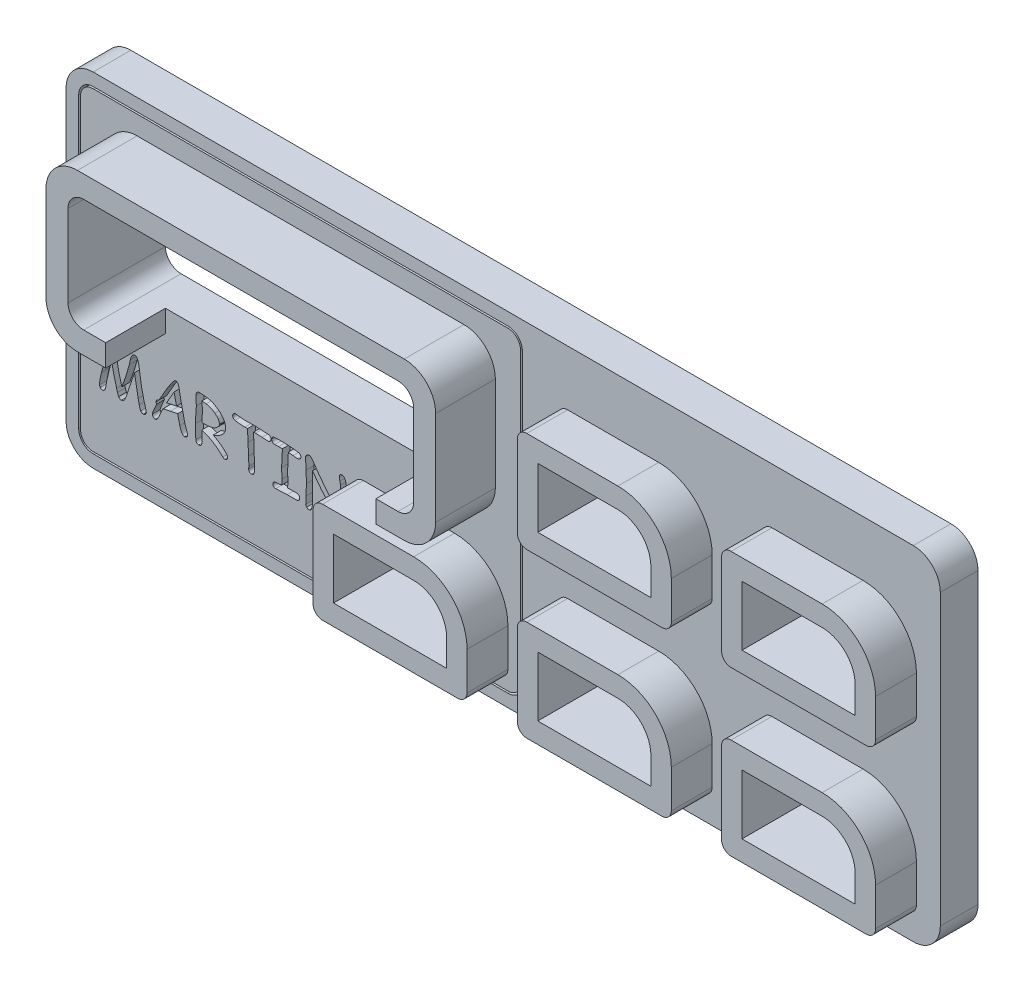
from build123d import *

# Parameters (mm, degrees)
BOSS_EXTRU_1_DEPTH      = 6
BOSS_EXTRU_2_DEPTH      = 9.5
BOSS_EXTRU_3_DEPTH      = 6.5
ENL_V_MAT_EXTRU_1_DEPTH = 87.546230421
ENL_V_MAT_EXTRU_2_DEPTH = 1.25
BOSS_EXTRU_4_DEPTH      = 12.5
BOSS_EXTRU_4_2_DEPTH    = 12.5
BOSS_EXTRU_4_3_DEPTH    = 12.5
BOSS_EXTRU_4_4_DEPTH    = 12.5
BOSS_EXTRU_5_DEPTH      = 6


with BuildPart() as part:
    # Esquisse1 → Boss.-Extru.1 (new body)
    with BuildSketch(Plane.XY):
        with BuildLine():
            Line((2, 0), (68, 0))
            ThreePointArc((68, 0), (69.414213562, 0.585786438), (70, 2))
            Line((70, 2), (70, 48))
            ThreePointArc((70, 48), (69.414213562, 49.414213562), (68, 50))
            Line((68, 50), (2, 50))
            ThreePointArc((2, 50), (0.585786438, 49.414213562), (0, 48))
            Line((0, 48), (0, 2))
            ThreePointArc((0, 2), (0.585786438, 0.585786438), (2, 0))
        make_face()
    extrude(amount=BOSS_EXTRU_1_DEPTH)

    # Esquisse2 → Boss.-Extru.2 (add)
    with BuildSketch(Plane.XY.offset(6)):
        with BuildLine():
            Line((9, 47), (61, 47))
            ThreePointArc((61, 47), (64.535533906, 45.535533906), (66, 42))
            Line((66, 42), (66, 27))
            ThreePointArc((66, 27), (64.535533906, 23.464466094), (61, 22))
            Line((61, 22), (56.5, 22))
            Line((56.5, 22), (56.5, 25.5))
            Line((56.5, 25.5), (60, 25.5))
            ThreePointArc((60, 25.5), (61.767766953, 26.232233047), (62.5, 28))
            Line((62.5, 28), (62.5, 41))
            ThreePointArc((62.5, 41), (61.767766953, 42.767766953), (60, 43.5))
            Line((60, 43.5), (10, 43.5))
            ThreePointArc((10, 43.5), (8.232233047, 42.767766953), (7.5, 41))
            Line((7.5, 41), (7.5, 28))
            ThreePointArc((7.5, 28), (8.232233047, 26.232233047), (10, 25.5))
            Line((10, 25.5), (13.5, 25.5))
            Line((13.5, 25.5), (13.5, 22))
            Line((13.5, 22), (9, 22))
            ThreePointArc((9, 22), (5.464466094, 23.464466094), (4, 27))
            Line((4, 27), (4, 42))
            ThreePointArc((4, 42), (5.464466094, 45.535533906), (9, 47))
        make_face()
    extrude(amount=BOSS_EXTRU_2_DEPTH)

    # Esquisse4 → Boss.-Extru.3 (add)
    with BuildSketch(Plane.XY.offset(6)):
        with BuildLine():
            Line((45, 1.5), (66.5, 1.5))
            ThreePointArc((66.5, 1.5), (67.560660172, 1.939339828), (68, 3))
            Line((68, 3), (68, 9))
            ThreePointArc((68, 9), (65.51040764, 15.01040764), (59.5, 17.5))
            Line((59.5, 17.5), (45, 17.5))
            ThreePointArc((45, 17.5), (43.939339828, 17.060660172), (43.5, 16))
            Line((43.5, 16), (43.5, 3))
            ThreePointArc((43.5, 3), (43.939339828, 1.939339828), (45, 1.5))
        make_face()
        with BuildLine():
            Line((46.75, 4.75), (46.75, 14.25))
            Line((46.75, 14.25), (59.5, 14.25))
            ThreePointArc((59.5, 14.25), (63.212310601, 12.712310601), (64.75, 9))
            Line((64.75, 9), (64.75, 4.75))
            Line((64.75, 4.75), (46.75, 4.75))
        make_face(mode=Mode.SUBTRACT)
    extrude(amount=BOSS_EXTRU_3_DEPTH)

    # Esquisse5 → Enlèv. mat.-Extru.1 (cut, through all)
    with BuildSketch(Plane.XY.offset(6)):
        with BuildLine():
            Line((46.75, 4.75), (64.75, 4.75))
            Line((64.75, 4.75), (64.75, 9))
            ThreePointArc((64.75, 9), (63.212310601, 12.712310601), (59.5, 14.25))
            Line((59.5, 14.25), (46.75, 14.25))
            Line((46.75, 14.25), (46.75, 4.75))
        make_face()
        with BuildLine():
            Line((60, 25.5), (10, 25.5))
            ThreePointArc((10, 25.5), (8.232233047, 26.232233047), (7.5, 28))
            Line((7.5, 28), (7.5, 41))
            ThreePointArc((7.5, 41), (8.232233047, 42.767766953), (10, 43.5))
            Line((10, 43.5), (60, 43.5))
            ThreePointArc((60, 43.5), (61.767766953, 42.767766953), (62.5, 41))
            Line((62.5, 41), (62.5, 28))
            ThreePointArc((62.5, 28), (61.767766953, 26.232233047), (60, 25.5))
        make_face()
    extrude(amount=-ENL_V_MAT_EXTRU_1_DEPTH, mode=Mode.SUBTRACT)

    # Esquisse6 → Enlèv. mat.-Extru.2 (cut)
    # profile 1 of 6: a face of its own
    with BuildSketch(Plane.XY.offset(6)):
        with BuildLine():
            add(Edge.make_bspline(
                [(9.98125, 9.15), (9.94151225, 9.152572673), (9.863195503, 9.157642999), (9.753210696, 9.208851358), (9.655170057, 9.288929049), (9.60457435, 9.360022023), (9.577929688, 9.397460938)],
                knots=[0, 0, 0, 0, 0.959160072, 1.890351017, 2.889018652, 4, 4, 4, 4], degree=3))
            add(Edge.make_bspline(
                [(9.577929688, 9.397460938), (9.555039589, 9.437994011), (9.503936785, 9.528485264), (9.444559776, 9.689977546), (9.383582079, 9.884507049), (9.350820269, 10.027438016), (9.333203125, 10.104296875)],
                knots=[0, 0, 0, 0, 0.742751013, 1.658213032, 2.74074123, 4, 4, 4, 4], degree=3))
            Line((9.333203125, 10.104296875), (9.170507813, 10.897265625))
            add(Edge.make_bspline(
                [(9.170507813, 10.897265625), (9.162063675, 10.930478046), (9.144190904, 11.000775102), (9.120790184, 11.114387165), (9.090669195, 11.240473819), (9.063224027, 11.382219058), (9.030938447, 11.536818991), (9.000199405, 11.706212518), (8.966098288, 11.888970437), (8.928359571, 12.08553135), (8.892511406, 12.296435224), (8.852248192, 12.520464411), (8.811201363, 12.758809908), (8.769390414, 13.011457122), (8.723780906, 13.277899485), (8.677478841, 13.558204991), (8.629563722, 13.852141071), (8.597594428, 14.052724412), (8.58125, 14.155273438)],
                knots=[0, 0, 0, 0, 0.496658207, 1.051221438, 1.68101768, 2.375400972, 3.143623008, 3.970205625, 4.870641242, 5.838436678, 6.871229342, 7.971369117, 9.137717576, 10.376808206, 11.683232474, 13.055897193, 14.494815811, 16, 16, 16, 16], degree=3))
            Line((8.58125, 14.155273438), (7.643359375, 11.373046875))
            Line((7.643359375, 11.373046875), (7.365820313, 10.496679688))
            add(Edge.make_bspline(
                [(7.365820313, 10.496679688), (7.338399285, 10.413435477), (7.285871215, 10.253971808), (7.197076337, 10.029299386), (7.110227316, 9.826640315), (7.045261396, 9.702448964), (7.014453125, 9.643554688)],
                knots=[0, 0, 0, 0, 1.138108356, 2.180174859, 3.13699879, 4, 4, 4, 4], degree=3))
            add(Edge.make_bspline(
                [(7.014453125, 9.643554688), (6.998289241, 9.617971786), (6.966916713, 9.568317859), (6.909732883, 9.50452134), (6.850756066, 9.448298498), (6.786364608, 9.402949233), (6.717025251, 9.368507163), (6.643911558, 9.343787748), (6.566658978, 9.328283944), (6.513679359, 9.326107542), (6.48671875, 9.325)],
                knots=[0, 0, 0, 0, 1.12138879, 2.176506675, 3.170017907, 4.141537379, 5.087232601, 6.03413754, 6.999599269, 8, 8, 8, 8], degree=3))
            add(Edge.make_bspline(
                [(6.48671875, 9.325), (6.442895177, 9.327946144), (6.356824973, 9.333732419), (6.236381954, 9.386429395), (6.131236088, 9.471412651), (6.080120224, 9.547570594), (6.053320313, 9.5875)],
                knots=[0, 0, 0, 0, 0.986319395, 1.937147192, 2.918451782, 4, 4, 4, 4], degree=3))
            add(Edge.make_bspline(
                [(6.053320313, 9.5875), (6.035855727, 9.621866875), (5.999476197, 9.693454648), (5.954588697, 9.811564935), (5.90666618, 9.940597662), (5.880828501, 10.032979854), (5.867382813, 10.081054688)],
                knots=[0, 0, 0, 0, 0.874902059, 1.822461019, 2.866828981, 4, 4, 4, 4], degree=3))
            Line((5.867382813, 10.081054688), (5.733398438, 10.59375))
            add(Edge.make_bspline(
                [(5.733398438, 10.59375), (5.656503387, 10.869589158), (5.500506422, 11.429183974), (5.28647453, 12.287066879), (5.086738125, 13.173788865), (4.966930141, 13.776291049), (4.90625, 14.081445313)],
                knots=[0, 0, 0, 0, 0.958328754, 1.944161251, 2.958762347, 4, 4, 4, 4], degree=3))
            Line((4.90625, 14.081445313), (4.743554688, 13.2625))
            Line((4.743554688, 13.2625), (4.1625, 10.8453125))
            add(Edge.make_bspline(
                [(4.1625, 10.8453125), (4.159128915, 10.807911974), (4.151961622, 10.7283944), (4.134718723, 10.603184869), (4.114668068, 10.464942037), (4.08826968, 10.314124246), (4.056624354, 10.150630351), (4.021006682, 9.974272122), (3.981550861, 9.784994838), (3.952148665, 9.654905267), (3.936914063, 9.5875)],
                knots=[0, 0, 0, 0, 0.704684958, 1.498236636, 2.371575818, 3.326349705, 4.371405418, 5.496944069, 6.703053969, 8, 8, 8, 8], degree=3))
            add(Edge.make_bspline(
                [(3.936914063, 9.5875), (3.925292565, 9.559816052), (3.902977927, 9.506659624), (3.859959142, 9.435525488), (3.813644305, 9.373538656), (3.759625567, 9.323968639), (3.70011878, 9.284889215), (3.634820258, 9.257348339), (3.564073136, 9.240403308), (3.515005519, 9.238484143), (3.48984375, 9.2375)],
                knots=[0, 0, 0, 0, 1.182980922, 2.271462135, 3.271240398, 4.225523803, 5.148115151, 6.066492127, 7.00850128, 8, 8, 8, 8], degree=3))
            add(Edge.make_bspline(
                [(3.48984375, 9.2375), (3.454472301, 9.238987729), (3.386404423, 9.241850676), (3.290904348, 9.273867009), (3.20538017, 9.323395776), (3.161073954, 9.371539251), (3.138476563, 9.39609375)],
                knots=[0, 0, 0, 0, 1.060616523, 2.041022336, 3.000867405, 4, 4, 4, 4], degree=3))
            add(Edge.make_bspline(
                [(3.138476563, 9.39609375), (3.12104166, 9.419179036), (3.085832988, 9.465798296), (3.051523678, 9.547863698), (3.028089071, 9.636777468), (3.026050694, 9.698987924), (3.025, 9.731054688)],
                knots=[0, 0, 0, 0, 0.958743918, 1.936122096, 2.936161401, 4, 4, 4, 4], degree=3))
            add(Edge.make_bspline(
                [(3.025, 9.731054688), (3.026353012, 9.795783944), (3.029137867, 9.929013783), (3.042627838, 10.133943057), (3.068218521, 10.349523947), (3.102129656, 10.575737195), (3.146634661, 10.81314601), (3.199268474, 11.061430494), (3.264501854, 11.319927567), (3.312277094, 11.495260953), (3.33671875, 11.584960938)],
                knots=[0, 0, 0, 0, 0.824042072, 1.69609536, 2.612788883, 3.586582681, 4.607146524, 5.686861406, 6.816605879, 8, 8, 8, 8], degree=3))
            Line((3.33671875, 11.584960938), (3.833007813, 13.445703125))
            Line((3.833007813, 13.445703125), (4.094140625, 14.899023438))
            add(Edge.make_bspline(
                [(4.094140625, 14.899023438), (4.110582906, 14.980233399), (4.142162068, 15.136205836), (4.19403641, 15.358138464), (4.245898421, 15.558306367), (4.297370459, 15.736416976), (4.349692009, 15.892468872), (4.405229653, 16.025660067), (4.45769822, 16.138512248), (4.499107174, 16.202764612), (4.51796875, 16.23203125)],
                knots=[0, 0, 0, 0, 1.414207589, 2.716137283, 3.889666348, 4.943215356, 5.880445309, 6.696617245, 7.406315533, 8, 8, 8, 8], degree=3))
            add(Edge.make_bspline(
                [(4.51796875, 16.23203125), (4.548533457, 16.272930794), (4.6064531, 16.350434791), (4.717889984, 16.43574033), (4.839406063, 16.49138048), (4.925721464, 16.497115246), (4.969140625, 16.5)],
                knots=[0, 0, 0, 0, 1.116006581, 2.11481503, 3.051697038, 4, 4, 4, 4], degree=3))
            add(Edge.make_bspline(
                [(4.969140625, 16.5), (4.993398198, 16.499036319), (5.040679835, 16.49715796), (5.108511714, 16.4799833), (5.171594618, 16.453252287), (5.231241217, 16.417001332), (5.282784712, 16.365386574), (5.332355351, 16.307122891), (5.377081606, 16.23748239), (5.400068156, 16.185456331), (5.412109375, 16.158203125)],
                knots=[0, 0, 0, 0, 0.974538665, 1.899521645, 2.795144295, 3.726104902, 4.685870392, 5.714123837, 6.802572119, 8, 8, 8, 8], degree=3))
            add(Edge.make_bspline(
                [(5.412109375, 16.158203125), (5.428114759, 16.119657968), (5.463249552, 16.035044184), (5.508759543, 15.89174731), (5.554057721, 15.722035918), (5.60407409, 15.526430897), (5.652702557, 15.303353512), (5.701269434, 15.05336241), (5.751957602, 14.777187689), (5.784678347, 14.584156311), (5.801757813, 14.483398438)],
                knots=[0, 0, 0, 0, 0.581236301, 1.275921689, 2.09225498, 3.028489211, 4.088314635, 5.272448532, 6.576281799, 8, 8, 8, 8], degree=3))
            add(Edge.make_bspline(
                [(5.801757813, 14.483398438), (5.823031102, 14.355685849), (5.866113547, 14.097043652), (5.942758506, 13.706413045), (6.023898552, 13.306785849), (6.115469469, 12.899721392), (6.217726181, 12.485453636), (6.324923357, 12.062514015), (6.442655583, 11.632407427), (6.526446051, 11.343772331), (6.56875, 11.198046875)],
                knots=[0, 0, 0, 0, 0.920409794, 1.864004282, 2.829825251, 3.819421933, 4.829969225, 5.863304241, 6.92122972, 8, 8, 8, 8], degree=3))
            add(Edge.make_bspline(
                [(6.56875, 11.198046875), (6.682155475, 11.496367429), (6.910229065, 12.096329995), (7.222165177, 13.012908722), (7.511715835, 13.947889969), (7.683937107, 14.580851692), (7.770507813, 14.899023438)],
                knots=[0, 0, 0, 0, 0.983642058, 1.97823584, 2.98371701, 4, 4, 4, 4], degree=3))
            Line((7.770507813, 14.899023438), (7.911328125, 15.573046875))
            add(Edge.make_bspline(
                [(7.911328125, 15.573046875), (7.925476872, 15.637540159), (7.952577765, 15.761072339), (8.005515675, 15.934576295), (8.060410553, 16.090642404), (8.108565823, 16.183711011), (8.131445313, 16.227929688)],
                knots=[0, 0, 0, 0, 1.142374087, 2.188134223, 3.139147904, 4, 4, 4, 4], degree=3))
            add(Edge.make_bspline(
                [(8.131445313, 16.227929688), (8.146172186, 16.256653629), (8.174481358, 16.311869081), (8.227613444, 16.384044343), (8.282088562, 16.447413009), (8.342677808, 16.497667809), (8.406522637, 16.538808133), (8.474957802, 16.567441894), (8.548053684, 16.584588128), (8.598017581, 16.58651311), (8.623632813, 16.5875)],
                knots=[0, 0, 0, 0, 1.199142974, 2.305088297, 3.326121748, 4.301047848, 5.223219202, 6.142892288, 7.047907664, 8, 8, 8, 8], degree=3))
            add(Edge.make_bspline(
                [(8.623632813, 16.5875), (8.655883833, 16.585132725), (8.720720824, 16.580373588), (8.813686475, 16.540809425), (8.898020466, 16.476190969), (8.978882717, 16.390489263), (9.048344115, 16.276486198), (9.115321834, 16.141338256), (9.175332362, 15.980796661), (9.20788859, 15.864537268), (9.225195313, 15.802734375)],
                knots=[0, 0, 0, 0, 0.729308629, 1.466191666, 2.249505672, 3.126830601, 4.121493211, 5.262973959, 6.545011104, 8, 8, 8, 8], degree=3))
            add(Edge.make_bspline(
                [(9.225195313, 15.802734375), (9.231852988, 15.77819025), (9.246796308, 15.72310034), (9.264534003, 15.630571858), (9.285354113, 15.52080947), (9.307368515, 15.393729578), (9.328683573, 15.248638587), (9.351883716, 15.086392029), (9.376685821, 14.906401094), (9.392996762, 14.780546191), (9.4015625, 14.714453125)],
                knots=[0, 0, 0, 0, 0.553116127, 1.241483132, 2.04851274, 2.984162884, 4.047067603, 5.238941889, 6.55002235, 8, 8, 8, 8], degree=3))
            add(Edge.make_bspline(
                [(9.4015625, 14.714453125), (9.424472836, 14.543510031), (9.469411387, 14.208205706), (9.54128262, 13.71482398), (9.619909618, 13.24153677), (9.699547544, 12.786308182), (9.786561858, 12.350917727), (9.87426295, 11.933409188), (9.968901843, 11.535732967), (10.035968408, 11.277691215), (10.06875, 11.1515625)],
                knots=[0, 0, 0, 0, 1.141110976, 2.238285472, 3.29858376, 4.315316321, 5.295745137, 6.236035004, 7.137788224, 8, 8, 8, 8], degree=3))
            Line((10.06875, 11.1515625), (10.290234375, 10.35859375))
            add(Edge.make_bspline(
                [(10.290234375, 10.35859375), (10.304152607, 10.309897656), (10.330495592, 10.217730742), (10.364191713, 10.085641741), (10.394375123, 9.968668577), (10.419762117, 9.866377837), (10.436890026, 9.778512725), (10.451030498, 9.706234173), (10.460244137, 9.648340815), (10.461821186, 9.614409735), (10.4625, 9.599804688)],
                knots=[0, 0, 0, 0, 1.559778982, 2.952187862, 4.198165584, 5.280768401, 6.197425036, 6.954465388, 7.549967658, 8, 8, 8, 8], degree=3))
            add(Edge.make_bspline(
                [(10.4625, 9.599804688), (10.460614745, 9.569071514), (10.456906327, 9.50861738), (10.428729188, 9.421732281), (10.380767792, 9.343768475), (10.31642298, 9.276162954), (10.241096223, 9.220981098), (10.158690532, 9.180554741), (10.071676174, 9.154571466), (10.011506374, 9.151529601), (9.98125, 9.15)],
                knots=[0, 0, 0, 0, 1.009991958, 1.986719327, 2.968954602, 3.997799753, 5.038376203, 6.024038288, 7.006387982, 8, 8, 8, 8], degree=3))
        make_face()
    # profile 2 of 6: a face of its own
    with BuildSketch(Plane.XY.offset(6)):
        with BuildLine():
            add(Edge.make_bspline(
                [(16.54375, 9.325), (16.507536074, 9.328565585), (16.432608606, 9.335942865), (16.326602225, 9.396120328), (16.225610725, 9.487618401), (16.131539169, 9.616736153), (16.038121522, 9.778218947), (15.951174204, 9.976013991), (15.866187745, 10.208556854), (15.816750923, 10.376947), (15.790429688, 10.466601563)],
                knots=[0, 0, 0, 0, 0.599477061, 1.240332184, 1.981336902, 2.857725237, 3.883632495, 5.081363646, 6.446054773, 8, 8, 8, 8], degree=3))
            add(Edge.make_bspline(
                [(15.790429688, 10.466601563), (15.779364183, 10.505302667), (15.755474944, 10.588854211), (15.71991042, 10.724120632), (15.683440927, 10.879306311), (15.643453762, 11.054142275), (15.602836847, 11.249302879), (15.560648196, 11.464541498), (15.515617335, 11.699261103), (15.48502816, 11.862488099), (15.469140625, 11.947265625)],
                knots=[0, 0, 0, 0, 0.637338617, 1.375945868, 2.214304435, 3.161358364, 4.215706084, 5.370487761, 6.634272836, 8, 8, 8, 8], degree=3))
            add(Edge.make_bspline(
                [(15.469140625, 11.947265625), (15.387937427, 11.934530903), (15.213659683, 11.907199731), (14.935787991, 11.852654767), (14.62282044, 11.785403771), (14.402668317, 11.734737591), (14.286523438, 11.708007812)],
                knots=[0, 0, 0, 0, 0.817199407, 1.753867738, 2.815015916, 4, 4, 4, 4], degree=3))
            Line((14.286523438, 11.708007812), (13.109375, 11.445507813))
            add(Edge.make_bspline(
                [(13.109375, 11.445507813), (13.087651476, 11.392124657), (13.04145529, 11.278602642), (12.965094843, 11.10029647), (12.877606786, 10.904751644), (12.778006467, 10.692668744), (12.671048039, 10.461138264), (12.550143165, 10.213472963), (12.420421388, 9.947478818), (12.329323456, 9.765157225), (12.282226563, 9.670898438)],
                knots=[0, 0, 0, 0, 0.706283328, 1.501947701, 2.37692242, 3.331414503, 4.373290632, 5.502321144, 6.708720252, 8, 8, 8, 8], degree=3))
            add(Edge.make_bspline(
                [(12.282226563, 9.670898438), (12.25762778, 9.631616858), (12.211341109, 9.557702077), (12.116699493, 9.473585909), (12.0076584, 9.421463966), (11.92959772, 9.415524694), (11.88984375, 9.4125)],
                knots=[0, 0, 0, 0, 1.121846996, 2.110940414, 3.037958462, 4, 4, 4, 4], degree=3))
            add(Edge.make_bspline(
                [(11.88984375, 9.4125), (11.860461387, 9.413913191), (11.801874975, 9.416730998), (11.717711394, 9.444642321), (11.637710506, 9.486347891), (11.564783249, 9.544409483), (11.504306702, 9.616370203), (11.456756219, 9.697042382), (11.431027995, 9.78787801), (11.427034679, 9.850768483), (11.425, 9.8828125)],
                knots=[0, 0, 0, 0, 0.959520236, 1.91321738, 2.874709434, 3.905108448, 4.94294104, 5.939035053, 6.949895042, 8, 8, 8, 8], degree=3))
            add(Edge.make_bspline(
                [(11.425, 9.8828125), (11.425677693, 9.893778715), (11.427243904, 9.919122661), (11.436305973, 9.961573968), (11.450737288, 10.013656046), (11.4672727, 10.076342009), (11.493752051, 10.14746261), (11.52107262, 10.229865272), (11.557813976, 10.320699165), (11.596801958, 10.422304152), (11.642576515, 10.533247664), (11.692450489, 10.65431778), (11.74921209, 10.784818465), (11.810727875, 10.924984751), (11.875799047, 11.076026087), (11.94869937, 11.235596519), (12.026728231, 11.404871319), (12.07991271, 11.521144948), (12.107226563, 11.580859375)],
                knots=[0, 0, 0, 0, 0.287252042, 0.663866255, 1.132542321, 1.702696392, 2.359033657, 3.117250718, 3.974454919, 4.922446686, 5.965676152, 7.11530323, 8.349438451, 9.690101266, 11.121599063, 12.65362027, 14.281406117, 16, 16, 16, 16], degree=3))
            add(Edge.make_bspline(
                [(12.107226563, 11.580859375), (12.095205464, 11.601506769), (12.071198403, 11.642741207), (12.046195032, 11.71098037), (12.033039273, 11.784062892), (12.030560908, 11.834196252), (12.029296875, 11.859765625)],
                knots=[0, 0, 0, 0, 0.97569968, 1.948547473, 2.953703556, 4, 4, 4, 4], degree=3))
            add(Edge.make_bspline(
                [(12.029296875, 11.859765625), (12.030564654, 11.889939801), (12.033017035, 11.948308483), (12.053179833, 12.032014057), (12.090602164, 12.10561148), (12.13815059, 12.17319498), (12.203119831, 12.22874239), (12.279378409, 12.277978072), (12.371137497, 12.315309671), (12.437428678, 12.333952783), (12.472265625, 12.34375)],
                knots=[0, 0, 0, 0, 1.009779751, 1.953309833, 2.853929492, 3.760216721, 4.700287016, 5.694855049, 6.788613926, 8, 8, 8, 8], degree=3))
            add(Edge.make_bspline(
                [(12.472265625, 12.34375), (12.516325928, 12.426770492), (12.606371171, 12.596437967), (12.747227716, 12.855087799), (12.897413309, 13.122485265), (13.056664472, 13.398481388), (13.221739586, 13.684964644), (13.396471267, 13.980011381), (13.581728953, 14.283023234), (13.707292343, 14.488411385), (13.77109375, 14.592773438)],
                knots=[0, 0, 0, 0, 0.868367668, 1.774667265, 2.721024516, 3.701824684, 4.718674562, 5.775854077, 6.869864537, 8, 8, 8, 8], degree=3))
            add(Edge.make_bspline(
                [(13.77109375, 14.592773438), (13.815130039, 14.662608689), (13.900835752, 14.798525684), (14.028175701, 14.994236668), (14.146218204, 15.178181707), (14.260441925, 15.346793437), (14.368266833, 15.501696885), (14.46778168, 15.644746484), (14.561960468, 15.77344413), (14.650905041, 15.887564915), (14.731799425, 15.98975151), (14.805888776, 16.078399739), (14.875242808, 16.152300533), (14.935466571, 16.214931929), (14.992275733, 16.261508521), (15.040940791, 16.296176013), (15.083923265, 16.319756585), (15.112106617, 16.323388709), (15.124609375, 16.325)],
                knots=[0, 0, 0, 0, 1.783354216, 3.470856639, 5.0436238, 6.504355625, 7.869725228, 9.120561833, 10.268459323, 11.314034723, 12.245706296, 13.083911902, 13.808382701, 14.434865381, 14.959203251, 15.390667921, 15.729686815, 16, 16, 16, 16], degree=3))
            add(Edge.make_bspline(
                [(15.124609375, 16.325), (15.153944582, 16.323447428), (15.210862302, 16.320435046), (15.292913508, 16.296035823), (15.367231786, 16.255953105), (15.434598298, 16.19999998), (15.491533063, 16.126587706), (15.544306187, 16.040017221), (15.587316522, 15.936398531), (15.609336888, 15.861303051), (15.620898438, 15.821875)],
                knots=[0, 0, 0, 0, 0.917322695, 1.779838015, 2.65454497, 3.546200046, 4.500090635, 5.550022207, 6.713666244, 8, 8, 8, 8], degree=3))
            Line((15.620898438, 15.821875), (15.917578125, 14.27421875))
            Line((15.917578125, 14.27421875), (16.6203125, 11.070898438))
            Line((16.6203125, 11.070898438), (16.88828125, 10.318945313))
            add(Edge.make_bspline(
                [(16.88828125, 10.318945313), (16.909005878, 10.26035528), (16.946523395, 10.154290523), (16.987971993, 10.009418378), (17.017986515, 9.897191516), (17.022948872, 9.831878941), (17.025, 9.804882813)],
                knots=[0, 0, 0, 0, 1.397155254, 2.529251602, 3.392084717, 4, 4, 4, 4], degree=3))
            add(Edge.make_bspline(
                [(17.025, 9.804882813), (17.023123196, 9.772332192), (17.019432209, 9.708317037), (16.991382828, 9.616791679), (16.944693063, 9.533442771), (16.880954012, 9.461474286), (16.806082373, 9.4010565), (16.723591166, 9.356969944), (16.635284445, 9.329183436), (16.574484659, 9.326404679), (16.54375, 9.325)],
                knots=[0, 0, 0, 0, 1.035843273, 2.037124518, 3.018631196, 4.058029714, 5.080662642, 6.067951126, 7.02333764, 8, 8, 8, 8], degree=3))
        make_face()
        with BuildLine():
            Line((14.88125, 14.65703125), (13.69453125, 12.570703125))
            add(Edge.make_bspline(
                [(13.69453125, 12.570703125), (13.740514866, 12.582285421), (13.837743248, 12.606775185), (13.992539452, 12.641512052), (14.163044415, 12.680722848), (14.351196407, 12.718125159), (14.555829596, 12.759055244), (14.776999698, 12.803565221), (15.015250076, 12.846341988), (15.179307554, 12.876441999), (15.2640625, 12.891992188)],
                knots=[0, 0, 0, 0, 0.710206803, 1.501670901, 2.376034108, 3.330493633, 4.374633661, 5.501772615, 6.709372284, 8, 8, 8, 8], degree=3))
            Line((15.2640625, 12.891992188), (14.88125, 14.65703125))
        make_face(mode=Mode.SUBTRACT)
    # profile 3 of 6: a face of its own
    with BuildSketch(Plane.XY.offset(6)):
        with BuildLine():
            add(Edge.make_bspline(
                [(22.950390625, 9.4125), (22.92238765, 9.414510918), (22.865540144, 9.418593187), (22.782278573, 9.447190523), (22.702332537, 9.495373725), (22.655250588, 9.538712067), (22.63046875, 9.561523438)],
                knots=[0, 0, 0, 0, 0.92759402, 1.883064472, 2.885739552, 4, 4, 4, 4], degree=3))
            add(Edge.make_bspline(
                [(22.63046875, 9.561523438), (22.505127147, 9.685094519), (22.257579548, 9.929145367), (21.867277515, 10.265936566), (21.46539548, 10.570250692), (21.053812761, 10.844216362), (20.631658252, 11.087395088), (20.198511969, 11.298070362), (19.755377923, 11.479192469), (19.451602907, 11.573461577), (19.3, 11.620507813)],
                knots=[0, 0, 0, 0, 1.06668371, 2.106682745, 3.122149944, 4.120443899, 5.101746213, 6.072804342, 7.03820772, 8, 8, 8, 8], degree=3))
            Line((19.3, 11.620507813), (19.3, 10.7140625))
            Line((19.3, 10.7140625), (19.3, 9.802148438))
            add(Edge.make_bspline(
                [(19.3, 9.802148438), (19.298575439, 9.769619921), (19.295777751, 9.705737357), (19.269213465, 9.614153806), (19.224138455, 9.531752829), (19.163822567, 9.459886848), (19.092007962, 9.398794664), (19.007981672, 9.356450611), (18.916170204, 9.328930531), (18.851767086, 9.326332112), (18.81875, 9.325)],
                knots=[0, 0, 0, 0, 1.030253241, 2.023308341, 2.993791058, 3.989789173, 4.985787287, 5.962283232, 6.955338332, 8, 8, 8, 8], degree=3))
            add(Edge.make_bspline(
                [(18.81875, 9.325), (18.785742823, 9.326344805), (18.721359032, 9.328967981), (18.629408852, 9.356310377), (18.545839957, 9.399346378), (18.472022478, 9.457984244), (18.411835379, 9.530139876), (18.368578352, 9.613162113), (18.341629188, 9.704326001), (18.338893163, 9.768237831), (18.3375, 9.80078125)],
                knots=[0, 0, 0, 0, 1.045277453, 2.038917917, 3.015989466, 4.014672757, 5.011257971, 5.975499002, 6.969139467, 8, 8, 8, 8], degree=3))
            add(Edge.make_bspline(
                [(18.3375, 9.80078125), (18.337723518, 9.833141132), (18.338195817, 9.901518618), (18.334211463, 10.009492975), (18.332730982, 10.128957481), (18.32591871, 10.259220182), (18.32171365, 10.401046565), (18.31213825, 10.553607753), (18.305335006, 10.717795126), (18.293043105, 10.888995802), (18.284890182, 11.06091105), (18.274015453, 11.225314296), (18.268529703, 11.378549592), (18.260204324, 11.520182528), (18.257493838, 11.650606668), (18.252032287, 11.769948174), (18.251610624, 11.877999826), (18.250517444, 11.946355564), (18.25, 11.978710938)],
                knots=[0, 0, 0, 0, 0.712445534, 1.505420618, 2.378647905, 3.342790384, 4.377117212, 5.50258648, 6.708224005, 7.995139022, 9.281467094, 10.497664906, 11.622642009, 12.657406812, 13.6211837, 14.49469921, 15.287483804, 16, 16, 16, 16], degree=3))
            add(Edge.make_bspline(
                [(18.25, 11.978710938), (18.250292594, 12.016539548), (18.250909659, 12.09631791), (18.255317283, 12.22211666), (18.262231396, 12.360667355), (18.271907627, 12.512430791), (18.284213627, 12.677413705), (18.299326666, 12.855149892), (18.317169571, 13.045644775), (18.33748721, 13.244727763), (18.357926095, 13.444255114), (18.375599003, 13.635221746), (18.39072972, 13.81295506), (18.403085284, 13.977022097), (18.412818415, 14.127871345), (18.419639956, 14.265515151), (18.424093913, 14.390400289), (18.42470868, 14.469267633), (18.425, 14.506640625)],
                knots=[0, 0, 0, 0, 0.71629614, 1.510627306, 2.383268869, 3.343040369, 4.390087922, 5.51592497, 6.720652734, 8.012939535, 9.305226336, 10.51854632, 11.644383367, 12.682825442, 13.633984758, 14.506626321, 15.292332674, 16, 16, 16, 16], degree=3))
            add(Edge.make_bspline(
                [(18.425, 14.506640625), (18.424371088, 14.550855493), (18.422982756, 14.64846043), (18.413898385, 14.808900614), (18.400245784, 14.99759589), (18.38125, 15.205273438), (18.362254216, 15.412950985), (18.348601615, 15.601646261), (18.339517244, 15.762086445), (18.338128912, 15.859691382), (18.3375, 15.90390625)],
                knots=[0, 0, 0, 0, 0.757749544, 1.672742668, 2.753375099, 4, 5.246624901, 6.327257332, 7.242250456, 8, 8, 8, 8], degree=3))
            add(Edge.make_bspline(
                [(18.3375, 15.90390625), (18.3393976, 15.94643752), (18.343131374, 16.030123308), (18.37085098, 16.151320483), (18.417670591, 16.265008777), (18.463397339, 16.332089732), (18.486523438, 16.366015625)],
                knots=[0, 0, 0, 0, 1.032692214, 2.03195585, 3.004670488, 4, 4, 4, 4], degree=3))
            add(Edge.make_bspline(
                [(18.486523438, 16.366015625), (18.517044009, 16.403076696), (18.576507203, 16.475282737), (18.695889264, 16.549213446), (18.831601871, 16.58986915), (18.926472352, 16.588312351), (18.975976563, 16.5875)],
                knots=[0, 0, 0, 0, 1.01891203, 1.985145153, 2.948631896, 4, 4, 4, 4], degree=3))
            Line((18.975976563, 16.5875), (20.0984375, 16.5))
            add(Edge.make_bspline(
                [(20.0984375, 16.5), (20.20082844, 16.48525505), (20.399327452, 16.456669923), (20.682000698, 16.388090857), (20.941102792, 16.302030268), (21.099006604, 16.225494042), (21.17578125, 16.18828125)],
                knots=[0, 0, 0, 0, 1.100642549, 2.133747954, 3.092606825, 4, 4, 4, 4], degree=3))
            add(Edge.make_bspline(
                [(21.17578125, 16.18828125), (21.252287922, 16.147059192), (21.402085268, 16.066347868), (21.615675484, 15.935691733), (21.815127668, 15.802198266), (22.000015549, 15.665453196), (22.170354521, 15.526007768), (22.325420712, 15.382419869), (22.464850714, 15.234227421), (22.591181779, 15.084151525), (22.702690238, 14.930469398), (22.799043555, 14.772878426), (22.879244074, 14.610951494), (22.947750004, 14.446700368), (22.997557171, 14.277699156), (23.034593311, 14.105920016), (23.059303933, 13.930859032), (23.061431984, 13.812647661), (23.0625, 13.753320313)],
                knots=[0, 0, 0, 0, 1.285088098, 2.516156837, 3.70133193, 4.833679489, 5.915871266, 6.955543635, 7.956797627, 8.923330369, 9.854944987, 10.762351267, 11.651551949, 12.525187581, 13.390909519, 14.252845023, 15.123146355, 16, 16, 16, 16], degree=3))
            add(Edge.make_bspline(
                [(23.0625, 13.753320313), (23.060818915, 13.695302631), (23.057486362, 13.580289374), (23.025843292, 13.410470425), (22.975881802, 13.245766492), (22.902527622, 13.087133827), (22.813144739, 12.932008513), (22.700138336, 12.783813572), (22.569094311, 12.639255424), (22.46871611, 12.551496093), (22.4171875, 12.506445313)],
                knots=[0, 0, 0, 0, 0.958014663, 1.899151822, 2.844979062, 3.795592604, 4.781247835, 5.798066499, 6.869649273, 8, 8, 8, 8], degree=3))
            add(Edge.make_bspline(
                [(22.4171875, 12.506445313), (22.372918009, 12.470837154), (22.283515343, 12.398926132), (22.141235348, 12.299864386), (21.991614403, 12.205847714), (21.83310445, 12.120653755), (21.666958147, 12.040344199), (21.491933387, 11.969152915), (21.310036543, 11.900976333), (21.184664559, 11.862744908), (21.12109375, 11.843359375)],
                knots=[0, 0, 0, 0, 0.929713851, 1.877566122, 2.835927701, 3.820636964, 4.821600353, 5.855058901, 6.912391442, 8, 8, 8, 8], degree=3))
            add(Edge.make_bspline(
                [(21.12109375, 11.843359375), (21.23864568, 11.778952798), (21.468066009, 11.653253644), (21.797375765, 11.456097485), (22.102948803, 11.255204567), (22.38745302, 11.053413827), (22.646866964, 10.846732266), (22.884359503, 10.638971065), (23.099166889, 10.428590249), (23.227896318, 10.281479329), (23.290820313, 10.209570313)],
                knots=[0, 0, 0, 0, 1.177489967, 2.298049355, 3.370731458, 4.389520182, 5.361182849, 6.283175119, 7.160802, 8, 8, 8, 8], degree=3))
            add(Edge.make_bspline(
                [(23.290820313, 10.209570313), (23.309379205, 10.185030422), (23.345171872, 10.137702808), (23.384906418, 10.059509993), (23.406940236, 9.977884118), (23.410655227, 9.922579893), (23.4125, 9.895117188)],
                knots=[0, 0, 0, 0, 1.072503085, 2.068428621, 3.040829592, 4, 4, 4, 4], degree=3))
            add(Edge.make_bspline(
                [(23.4125, 9.895117188), (23.411118609, 9.863476997), (23.408405682, 9.801338513), (23.380854999, 9.711517788), (23.336381763, 9.628736266), (23.276559187, 9.554141858), (23.20522507, 9.492041587), (23.126314556, 9.445275538), (23.040034816, 9.418364939), (22.980648846, 9.414479633), (22.950390625, 9.4125)],
                knots=[0, 0, 0, 0, 1.024641278, 2.012303189, 3.018298371, 4.060307688, 5.098529397, 6.072917027, 7.018116539, 8, 8, 8, 8], degree=3))
        make_face()
        with BuildLine():
            Line((19.979492188, 15.568945313), (19.3, 15.625))
            Line((19.3, 15.625), (19.351953125, 15.064453125))
            add(Edge.make_bspline(
                [(19.351953125, 15.064453125), (19.356931875, 15.009766098), (19.366388259, 14.90589635), (19.380383957, 14.757961107), (19.384868696, 14.625610016), (19.386662493, 14.542642832), (19.3875, 14.50390625)],
                knots=[0, 0, 0, 0, 1.172826967, 2.227607707, 3.172487062, 4, 4, 4, 4], degree=3))
            add(Edge.make_bspline(
                [(19.3875, 14.50390625), (19.387430948, 14.438273937), (19.387285137, 14.299682992), (19.378868646, 14.080512688), (19.370480514, 13.838419289), (19.360111633, 13.66944692), (19.3546875, 13.581054688)],
                knots=[0, 0, 0, 0, 0.852682441, 1.800547017, 2.849429868, 4, 4, 4, 4], degree=3))
            Line((19.3546875, 13.581054688), (19.3, 12.659570313))
            add(Edge.make_bspline(
                [(19.3, 12.659570313), (19.326891635, 12.659247301), (19.391633142, 12.658469652), (19.494566386, 12.653559442), (19.598496717, 12.651484424), (19.664583279, 12.650439536), (19.692382813, 12.65)],
                knots=[0, 0, 0, 0, 0.822146546, 1.979314634, 3.149991952, 4, 4, 4, 4], degree=3))
            add(Edge.make_bspline(
                [(19.692382813, 12.65), (19.784455222, 12.651227155), (19.962323103, 12.653597805), (20.220569168, 12.666736501), (20.461161952, 12.690716802), (20.68369085, 12.726562137), (20.888513575, 12.769552387), (21.075550732, 12.822842821), (21.24552326, 12.885521948), (21.34895686, 12.938844132), (21.398632813, 12.964453125)],
                knots=[0, 0, 0, 0, 1.261455283, 2.436912221, 3.541518553, 4.572091567, 5.523601269, 6.40695542, 7.234910064, 8, 8, 8, 8], degree=3))
            add(Edge.make_bspline(
                [(21.398632813, 12.964453125), (21.440099733, 12.989758578), (21.523838727, 13.040860833), (21.642005737, 13.130467108), (21.757190538, 13.229077091), (21.827631314, 13.302875723), (21.863476563, 13.340429688)],
                knots=[0, 0, 0, 0, 0.970995645, 1.960844865, 2.962333636, 4, 4, 4, 4], degree=3))
            add(Edge.make_bspline(
                [(21.863476563, 13.340429688), (21.899360811, 13.380976175), (21.965723864, 13.455961407), (22.039412482, 13.572205852), (22.089263575, 13.678429068), (22.096606423, 13.748349555), (22.1, 13.780664063)],
                knots=[0, 0, 0, 0, 1.272857899, 2.353978121, 3.239273211, 4, 4, 4, 4], degree=3))
            add(Edge.make_bspline(
                [(22.1, 13.780664063), (22.097969529, 13.834154951), (22.093901441, 13.941325031), (22.058406458, 14.099954777), (21.999101372, 14.254251603), (21.921403432, 14.407866005), (21.816920148, 14.556453524), (21.692186994, 14.703585182), (21.542955517, 14.845868818), (21.432577757, 14.934917981), (21.375390625, 14.981054688)],
                knots=[0, 0, 0, 0, 0.882366302, 1.767838804, 2.667832895, 3.606679194, 4.602184672, 5.659035605, 6.787137544, 8, 8, 8, 8], degree=3))
            add(Edge.make_bspline(
                [(21.375390625, 14.981054688), (21.320236706, 15.021785547), (21.211175063, 15.102326957), (21.041883579, 15.21074683), (20.868831136, 15.303216304), (20.695315993, 15.384555504), (20.519496116, 15.452062717), (20.341660536, 15.505131842), (20.161736379, 15.5459194), (20.040267206, 15.561266603), (19.979492188, 15.568945313)],
                knots=[0, 0, 0, 0, 1.072583951, 2.120933036, 3.141837587, 4.140335143, 5.117603438, 6.085357071, 7.042041242, 8, 8, 8, 8], degree=3))
        make_face(mode=Mode.SUBTRACT)
    # profile 4 of 6: a face of its own
    with BuildSketch(Plane.XY.offset(6)):
        with BuildLine():
            add(Edge.make_bspline(
                [(29.875195313, 15.348828125), (29.845571421, 15.34920634), (29.783124599, 15.350003613), (29.683772648, 15.352917005), (29.573488268, 15.357104505), (29.451756856, 15.362181648), (29.319190552, 15.370947848), (29.175177065, 15.380453154), (29.020220866, 15.391303672), (28.913147362, 15.399364531), (28.858007813, 15.403515625)],
                knots=[0, 0, 0, 0, 0.697868793, 1.471099364, 2.34124454, 3.297639375, 4.340941311, 5.470636532, 6.697455892, 8, 8, 8, 8], degree=3))
            add(Edge.make_bspline(
                [(28.858007813, 15.403515625), (28.753210921, 15.411137837), (28.557368604, 15.425382074), (28.283447378, 15.440444643), (28.049611571, 15.449748084), (27.90690768, 15.449921398), (27.8421875, 15.45)],
                knots=[0, 0, 0, 0, 1.239602774, 2.316544658, 3.236506215, 4, 4, 4, 4], degree=3))
            Line((27.8421875, 15.45), (27.525, 15.45))
            add(Edge.make_bspline(
                [(27.525, 15.45), (27.52574906, 15.393030335), (27.527355271, 15.270870224), (27.533527125, 15.074929622), (27.540106198, 14.854349852), (27.548583245, 14.608720233), (27.557602236, 14.338888879), (27.570665174, 14.044079121), (27.583702721, 13.724564527), (27.594563303, 13.503117703), (27.600195313, 13.38828125)],
                knots=[0, 0, 0, 0, 0.662748673, 1.421132645, 2.280353958, 3.229821545, 4.280136861, 5.420916878, 6.662555861, 8, 8, 8, 8], degree=3))
            add(Edge.make_bspline(
                [(27.600195313, 13.38828125), (27.605326267, 13.280734759), (27.615304223, 13.071593518), (27.627895574, 12.766712353), (27.636421387, 12.480444812), (27.647001884, 12.212996662), (27.653825754, 11.964154026), (27.657612696, 11.733535636), (27.66056299, 11.521621148), (27.661345847, 11.386719544), (27.66171875, 11.322460938)],
                knots=[0, 0, 0, 0, 1.250205099, 2.431222486, 3.543103862, 4.575656673, 5.539115669, 6.433559639, 7.253846715, 8, 8, 8, 8], degree=3))
            add(Edge.make_bspline(
                [(27.66171875, 11.322460938), (27.662012762, 11.291922861), (27.662662425, 11.22444442), (27.667660006, 11.112823881), (27.672430645, 10.980611598), (27.681090313, 10.834384754), (27.688427501, 10.688080916), (27.696519153, 10.555089849), (27.698596827, 10.441997388), (27.699564342, 10.373176559), (27.7, 10.3421875)],
                knots=[0, 0, 0, 0, 0.746989454, 1.650584799, 2.732845727, 3.983195791, 5.233545855, 6.316323389, 7.241863914, 8, 8, 8, 8], degree=3))
            add(Edge.make_bspline(
                [(27.7, 10.3421875), (27.698501643, 10.292009962), (27.695590606, 10.1945241), (27.678530155, 10.053718265), (27.647400371, 9.92326437), (27.61570312, 9.842855488), (27.600195313, 9.803515625)],
                knots=[0, 0, 0, 0, 1.091849351, 2.121265404, 3.080833362, 4, 4, 4, 4], degree=3))
            add(Edge.make_bspline(
                [(27.600195313, 9.803515625), (27.589217013, 9.779610744), (27.568253435, 9.733963255), (27.53139939, 9.67126921), (27.48886826, 9.618256355), (27.440224858, 9.576467866), (27.389615603, 9.540150762), (27.332123568, 9.518035605), (27.271643988, 9.501412087), (27.229355195, 9.50047657), (27.2078125, 9.5)],
                knots=[0, 0, 0, 0, 1.191296126, 2.274835755, 3.287394835, 4.252751747, 5.174740045, 6.091162971, 7.027603017, 8, 8, 8, 8], degree=3))
            add(Edge.make_bspline(
                [(27.2078125, 9.5), (27.178456486, 9.50151727), (27.120055151, 9.504535753), (27.03542781, 9.530863808), (26.954780829, 9.571039837), (26.880392229, 9.626277465), (26.817213501, 9.695480476), (26.771494387, 9.776366042), (26.742719566, 9.866336145), (26.739275459, 9.929531682), (26.7375, 9.962109375)],
                knots=[0, 0, 0, 0, 0.960963467, 1.911756486, 2.881171454, 3.906711639, 4.933449695, 5.93104195, 6.933439213, 8, 8, 8, 8], degree=3))
            add(Edge.make_bspline(
                [(26.7375, 9.962109375), (26.738825254, 9.990872928), (26.742017987, 10.060168568), (26.760889084, 10.168989127), (26.779378507, 10.277866645), (26.782639525, 10.347606396), (26.783984375, 10.376367188)],
                knots=[0, 0, 0, 0, 0.827477602, 1.993515503, 3.172522398, 4, 4, 4, 4], degree=3))
            add(Edge.make_bspline(
                [(26.783984375, 10.376367188), (26.783738235, 10.41875405), (26.783190207, 10.513127972), (26.777132663, 10.669010751), (26.767200264, 10.8530891), (26.755440569, 11.055867445), (26.742722688, 11.258577583), (26.735159258, 11.443204342), (26.728647133, 11.599954758), (26.728152215, 11.695242273), (26.727929688, 11.738085938)],
                knots=[0, 0, 0, 0, 0.746291465, 1.661610404, 2.746329365, 3.99217145, 5.238013535, 6.322346595, 7.245684818, 8, 8, 8, 8], degree=3))
            add(Edge.make_bspline(
                [(26.727929688, 11.738085938), (26.727500387, 11.795962949), (26.726601189, 11.917190259), (26.724645893, 12.107279782), (26.716555102, 12.314130331), (26.709193446, 12.537943966), (26.697367345, 12.778514177), (26.686155215, 13.035652873), (26.668595401, 13.309436548), (26.6572293, 13.497653108), (26.651367188, 13.594726563)],
                knots=[0, 0, 0, 0, 0.747431598, 1.565545969, 2.45468398, 3.420487031, 4.457335108, 5.565002064, 6.744139946, 8, 8, 8, 8], degree=3))
            add(Edge.make_bspline(
                [(26.651367188, 13.594726563), (26.644897607, 13.698627352), (26.632442426, 13.898656268), (26.615892146, 14.187584875), (26.602499592, 14.453771624), (26.590458578, 14.697141091), (26.578349672, 14.917627222), (26.572405555, 15.115492301), (26.56663801, 15.290482211), (26.563812281, 15.399412347), (26.5625, 15.45)],
                knots=[0, 0, 0, 0, 1.345045701, 2.589470545, 3.739184836, 4.788629233, 5.737804393, 6.592105666, 7.346167443, 8, 8, 8, 8], degree=3))
            Line((26.5625, 15.45), (26.145507813, 15.445898438))
            add(Edge.make_bspline(
                [(26.145507813, 15.445898438), (26.064382139, 15.446485222), (25.906203813, 15.44762933), (25.675570056, 15.454699619), (25.458502216, 15.464813722), (25.254782876, 15.481761081), (25.064626286, 15.501803702), (24.887548259, 15.525961621), (24.724277822, 15.555938997), (24.620550242, 15.580390901), (24.570507813, 15.5921875)],
                knots=[0, 0, 0, 0, 1.228039821, 2.394424294, 3.492699509, 4.517052489, 5.488393293, 6.38694271, 7.221795155, 8, 8, 8, 8], degree=3))
            add(Edge.make_bspline(
                [(24.570507813, 15.5921875), (24.541011869, 15.600883233), (24.484685655, 15.617488828), (24.408992856, 15.655064678), (24.343769889, 15.699045976), (24.291429793, 15.753411006), (24.249293643, 15.815574331), (24.221218472, 15.886603825), (24.202233209, 15.964894477), (24.200767243, 16.019991805), (24.2, 16.048828125)],
                knots=[0, 0, 0, 0, 1.149028852, 2.19421508, 3.150112674, 4.078991136, 5.001582701, 5.94244518, 6.923136375, 8, 8, 8, 8], degree=3))
            add(Edge.make_bspline(
                [(24.2, 16.048828125), (24.200972051, 16.079559497), (24.202888186, 16.140138098), (24.228265083, 16.226382282), (24.262887707, 16.308790626), (24.299117869, 16.355756902), (24.317578125, 16.3796875)],
                knots=[0, 0, 0, 0, 1.025624002, 2.021740715, 2.992022952, 4, 4, 4, 4], degree=3))
            add(Edge.make_bspline(
                [(24.317578125, 16.3796875), (24.341133316, 16.404194771), (24.386716948, 16.451620856), (24.472352415, 16.501148252), (24.567927351, 16.528258054), (24.634592958, 16.52765467), (24.668945313, 16.52734375)],
                knots=[0, 0, 0, 0, 1.02661616, 1.986691385, 2.962555135, 4, 4, 4, 4], degree=3))
            add(Edge.make_bspline(
                [(24.668945313, 16.52734375), (24.68444747, 16.526536799), (24.719605963, 16.524706656), (24.778399077, 16.518930808), (24.849846571, 16.510286974), (24.934176131, 16.500879811), (25.031788094, 16.490214928), (25.141960567, 16.476042628), (25.265132511, 16.461546986), (25.351188022, 16.449998032), (25.396289062, 16.443945312)],
                knots=[0, 0, 0, 0, 0.5087507, 1.153833472, 1.935733641, 2.867738609, 3.935007618, 5.154125614, 6.508498809, 8, 8, 8, 8], degree=3))
            add(Edge.make_bspline(
                [(25.396289062, 16.443945312), (25.468274172, 16.436024283), (25.605303613, 16.420945968), (25.800260139, 16.402208875), (25.974063176, 16.392759257), (26.082609628, 16.390370986), (26.133203125, 16.389257813)],
                knots=[0, 0, 0, 0, 1.175525529, 2.237707298, 3.178595432, 4, 4, 4, 4], degree=3))
            add(Edge.make_bspline(
                [(26.133203125, 16.389257813), (26.184244143, 16.389770995), (26.298629826, 16.390921065), (26.487779815, 16.391391348), (26.712423508, 16.396815395), (26.96036942, 16.399681613), (27.20826113, 16.405490273), (27.432925422, 16.410251814), (27.622072918, 16.41085743), (27.736458864, 16.411993199), (27.7875, 16.4125)],
                knots=[0, 0, 0, 0, 0.740441683, 1.659369853, 2.743726197, 3.999939121, 5.256273803, 6.340630147, 7.259558317, 8, 8, 8, 8], degree=3))
            add(Edge.make_bspline(
                [(27.7875, 16.4125), (27.818488307, 16.411987535), (27.884109857, 16.410902328), (27.987603054, 16.410394717), (28.101506478, 16.405394155), (28.225984309, 16.400684578), (28.361221846, 16.391270989), (28.507183199, 16.384273999), (28.663423207, 16.372528551), (28.826564282, 16.360576785), (28.990148268, 16.348415791), (29.146416746, 16.337154056), (29.292291584, 16.329051098), (29.427241506, 16.322791972), (29.552021945, 16.315100035), (29.665985487, 16.310872256), (29.769469178, 16.310147303), (29.834636182, 16.309094424), (29.865625, 16.30859375)],
                knots=[0, 0, 0, 0, 0.714819212, 1.513717576, 2.38669285, 3.344109317, 4.386598804, 5.513033055, 6.714223687, 8.000039341, 9.285854994, 10.497530974, 11.613470957, 12.65537741, 13.613313006, 14.496792413, 15.285180788, 16, 16, 16, 16], degree=3))
            add(Edge.make_bspline(
                [(29.865625, 16.30859375), (29.897276237, 16.307282372), (29.958561374, 16.304743198), (30.046274009, 16.277160019), (30.125087268, 16.232598176), (30.195091705, 16.172345998), (30.251353829, 16.098664904), (30.296147776, 16.016321216), (30.32033649, 15.923475639), (30.323424609, 15.858912944), (30.325, 15.825976563)],
                knots=[0, 0, 0, 0, 1.019441967, 1.973908376, 2.93606128, 3.927491239, 4.934424242, 5.91541954, 6.936560224, 8, 8, 8, 8], degree=3))
            add(Edge.make_bspline(
                [(30.325, 15.825976563), (30.323592848, 15.793420587), (30.320853723, 15.730047986), (30.294462483, 15.639579211), (30.255626868, 15.555553377), (30.197052293, 15.484297041), (30.130014224, 15.4236222), (30.052092552, 15.379933762), (29.96628595, 15.352958629), (29.905927723, 15.350221686), (29.875195313, 15.348828125)],
                knots=[0, 0, 0, 0, 1.065832428, 2.074721264, 3.071561902, 4.083108628, 5.07938795, 6.023783637, 6.993776074, 8, 8, 8, 8], degree=3))
        make_face()
    # profile 5 of 6: a face of its own
    with BuildSketch(Plane.XY.offset(6)):
        with BuildLine():
            add(Edge.make_bspline(
                [(34.567382813, 15.292773438), (34.514049332, 15.293766192), (34.400908997, 15.295872198), (34.221668147, 15.307234931), (34.023430673, 15.326823071), (33.885119971, 15.343957473), (33.812695313, 15.352929688)],
                knots=[0, 0, 0, 0, 0.844908799, 1.792368763, 2.844001688, 4, 4, 4, 4], degree=3))
            Line((33.812695313, 15.352929688), (33.058007813, 15.45))
            add(Edge.make_bspline(
                [(33.058007813, 15.45), (33.040978023, 15.227216526), (33.007323087, 14.786943122), (32.97618134, 14.133160187), (32.953936672, 13.494620294), (32.951301556, 13.073847034), (32.95, 12.866015625)],
                knots=[0, 0, 0, 0, 1.0364049, 2.048183843, 3.035944677, 4, 4, 4, 4], degree=3))
            add(Edge.make_bspline(
                [(32.95, 12.866015625), (32.950396347, 12.808593287), (32.951233111, 12.68736385), (32.953814414, 12.495484335), (32.959298287, 12.284467284), (32.967931865, 12.060746803), (32.975624261, 11.837441342), (32.983572759, 11.626938594), (32.985581884, 11.435484829), (32.986485873, 11.314257349), (32.986914063, 11.256835938)],
                knots=[0, 0, 0, 0, 0.856162641, 1.807521568, 2.861054983, 4.003296995, 5.145539007, 6.192478432, 7.143837359, 8, 8, 8, 8], degree=3))
            add(Edge.make_bspline(
                [(32.986914063, 11.256835938), (32.986944251, 11.185732368), (32.98700329, 11.046678942), (32.97893454, 10.843445807), (32.970789477, 10.649576073), (32.9595869, 10.523992133), (32.954101563, 10.4625)],
                knots=[0, 0, 0, 0, 1.072724937, 2.09787044, 3.068622912, 4, 4, 4, 4], degree=3))
            Line((32.954101563, 10.4625), (34.415625, 10.480273438))
            add(Edge.make_bspline(
                [(34.415625, 10.480273438), (34.447330095, 10.479119255), (34.508856855, 10.476879455), (34.595944636, 10.447015177), (34.67564408, 10.403161672), (34.744525994, 10.341140583), (34.80232018, 10.267250661), (34.845155141, 10.183430624), (34.870638294, 10.090721579), (34.873519882, 10.026527667), (34.875, 9.993554688)],
                knots=[0, 0, 0, 0, 1.016134692, 1.97190626, 2.930937747, 3.928796873, 4.932463183, 5.936343928, 6.940010237, 8, 8, 8, 8], degree=3))
            add(Edge.make_bspline(
                [(34.875, 9.993554688), (34.873587803, 9.959652888), (34.870855985, 9.894071751), (34.844852542, 9.799993144), (34.803948559, 9.714159162), (34.746271292, 9.639215635), (34.677168606, 9.57763546), (34.598089592, 9.532562977), (34.511008658, 9.503794777), (34.449572564, 9.501278446), (34.418359375, 9.5)],
                knots=[0, 0, 0, 0, 1.082704447, 2.094431231, 3.098879689, 4.108080834, 5.099958544, 6.040552062, 7.004483931, 8, 8, 8, 8], degree=3))
            add(Edge.make_bspline(
                [(34.418359375, 9.5), (34.370052083, 9.5), (34.2625, 9.5), (34.084765625, 9.5), (33.874674479, 9.5), (33.643164063, 9.5), (33.412109375, 9.5), (33.202473958, 9.5), (33.025195312, 9.5), (32.917643229, 9.5), (32.869335938, 9.5)],
                knots=[0, 0, 0, 0, 0.748455428, 1.666372462, 2.753751103, 4.00353045, 5.253309797, 6.333627538, 7.251544572, 8, 8, 8, 8], degree=3))
            add(Edge.make_bspline(
                [(32.869335938, 9.5), (32.812362762, 9.499368032), (32.686065123, 9.49796709), (32.477326523, 9.488834224), (32.230754043, 9.47528571), (31.95878914, 9.456248174), (31.686823791, 9.437221117), (31.439797728, 9.423621571), (31.22968994, 9.414510435), (31.10202528, 9.413127183), (31.044140625, 9.4125)],
                knots=[0, 0, 0, 0, 0.748172612, 1.658542507, 2.743409755, 3.991026145, 5.238642535, 6.323509783, 7.239859666, 8, 8, 8, 8], degree=3))
            add(Edge.make_bspline(
                [(31.044140625, 9.4125), (31.01300016, 9.414075343), (30.952532885, 9.417134281), (30.865421837, 9.441104499), (30.786627086, 9.481426283), (30.716845589, 9.536086766), (30.659649328, 9.602582205), (30.617675335, 9.677851338), (30.59189723, 9.76039496), (30.588985744, 9.817913613), (30.5875, 9.847265625)],
                knots=[0, 0, 0, 0, 1.063311923, 2.064695416, 3.06085606, 4.070443796, 5.075696449, 6.037910975, 6.998737659, 8, 8, 8, 8], degree=3))
            add(Edge.make_bspline(
                [(30.5875, 9.847265625), (30.589012656, 9.876616656), (30.591999404, 9.934570432), (30.617618453, 10.017314007), (30.658078377, 10.093304125), (30.714419372, 10.159807756), (30.782150395, 10.215220461), (30.858459445, 10.258097078), (30.943934392, 10.281234666), (31.002999083, 10.284475526), (31.033203125, 10.286132813)],
                knots=[0, 0, 0, 0, 1.010275739, 1.994795113, 2.958136824, 3.962281448, 4.978529793, 5.963174608, 6.958424075, 8, 8, 8, 8], degree=3))
            add(Edge.make_bspline(
                [(31.033203125, 10.286132813), (31.059639459, 10.286437863), (31.116640371, 10.287095601), (31.207806736, 10.291513082), (31.310812257, 10.298424041), (31.42564732, 10.308222374), (31.552908801, 10.320067562), (31.691704484, 10.337419523), (31.842673369, 10.354617342), (31.946956456, 10.368027982), (32.001171875, 10.375)],
                knots=[0, 0, 0, 0, 0.65235169, 1.406573319, 2.251878403, 3.199797556, 4.250540251, 5.405519862, 6.651163576, 8, 8, 8, 8], degree=3))
            add(Edge.make_bspline(
                [(32.001171875, 10.375), (32.008428112, 10.439672507), (32.023378127, 10.572917198), (32.03823199, 10.779941404), (32.04611959, 11.000195915), (32.047133951, 11.151556182), (32.04765625, 11.229492188)],
                knots=[0, 0, 0, 0, 0.911939611, 1.878868134, 2.907820727, 4, 4, 4, 4], degree=3))
            add(Edge.make_bspline(
                [(32.04765625, 11.229492188), (32.047445612, 11.285550584), (32.047000269, 11.404072553), (32.041141906, 11.590041987), (32.031451114, 11.793772598), (32.017849911, 12.00834578), (32.002809925, 12.22329154), (31.996538194, 12.425792215), (31.987605527, 12.610280201), (31.987534051, 12.727008253), (31.9875, 12.782617188)],
                knots=[0, 0, 0, 0, 0.865414781, 1.829710956, 2.872152674, 4.014099031, 5.149023177, 6.19818612, 7.141620645, 8, 8, 8, 8], degree=3))
            add(Edge.make_bspline(
                [(31.9875, 12.782617188), (31.987543968, 12.874224495), (31.987634761, 13.06338937), (31.995898806, 13.355034744), (32.004299439, 13.663648215), (32.02057019, 13.988512447), (32.037808115, 14.330362999), (32.059498219, 14.689087236), (32.08752154, 15.06405073), (32.107298764, 15.319666258), (32.117382813, 15.45)],
                knots=[0, 0, 0, 0, 0.823012946, 1.699483876, 2.621201366, 3.596742432, 4.621760727, 5.69652902, 6.825501744, 8, 8, 8, 8], degree=3))
            Line((32.117382813, 15.45), (31.504882813, 15.432226563))
            Line((31.504882813, 15.432226563), (30.889648438, 15.4171875))
            add(Edge.make_bspline(
                [(30.889648438, 15.4171875), (30.857081721, 15.418509378), (30.793563097, 15.421087588), (30.702737367, 15.448872249), (30.61956391, 15.491078105), (30.547027513, 15.550708365), (30.486339687, 15.622483299), (30.443937804, 15.706460266), (30.416173714, 15.799167579), (30.413755937, 15.86449997), (30.4125, 15.8984375)],
                knots=[0, 0, 0, 0, 1.028739135, 2.006468603, 2.981529445, 3.966904178, 4.961438528, 5.93649937, 6.928095031, 8, 8, 8, 8], degree=3))
            add(Edge.make_bspline(
                [(30.4125, 15.8984375), (30.41370207, 15.932709919), (30.415986535, 15.997842677), (30.436053477, 16.09009543), (30.472388801, 16.169097044), (30.520811338, 16.237614063), (30.585926255, 16.2907478), (30.662486748, 16.334708902), (30.754521618, 16.362698883), (30.820661422, 16.371142385), (30.85546875, 16.375585937)],
                knots=[0, 0, 0, 0, 1.124933062, 2.137870454, 3.075480577, 3.964534875, 4.867090771, 5.811958692, 6.848501675, 8, 8, 8, 8], degree=3))
            add(Edge.make_bspline(
                [(30.85546875, 16.375585937), (30.890554668, 16.378377963), (30.967976849, 16.384538973), (31.094165744, 16.393199539), (31.241473098, 16.397518766), (31.40914672, 16.403588231), (31.597838658, 16.407475101), (31.80748693, 16.409662142), (32.03762005, 16.413310054), (32.198045245, 16.412777078), (32.281445313, 16.4125)],
                knots=[0, 0, 0, 0, 0.592040121, 1.306422653, 2.127214331, 3.070581057, 4.128683212, 5.301619568, 6.59719597, 8, 8, 8, 8], degree=3))
            add(Edge.make_bspline(
                [(32.281445313, 16.4125), (32.362119255, 16.412057456), (32.52807924, 16.411147068), (32.78467901, 16.400526778), (33.05586928, 16.385604451), (33.342618417, 16.365238256), (33.643803039, 16.337357944), (33.960195802, 16.304902552), (34.29098259, 16.264806734), (34.516369382, 16.234980708), (34.631640625, 16.219726562)],
                knots=[0, 0, 0, 0, 0.820444117, 1.687792723, 2.611562117, 3.582764976, 4.611281913, 5.687725834, 6.817416436, 8, 8, 8, 8], degree=3))
            add(Edge.make_bspline(
                [(34.631640625, 16.219726562), (34.664662675, 16.213858024), (34.727376439, 16.2027128), (34.814246347, 16.171652234), (34.886093099, 16.126137548), (34.949295622, 16.073370462), (34.993534629, 16.003877424), (35.027711893, 15.925715559), (35.046097373, 15.835454768), (35.048658292, 15.771817288), (35.05, 15.738476563)],
                knots=[0, 0, 0, 0, 1.133235852, 2.152182755, 3.09298808, 3.998953257, 4.909232267, 5.848016526, 6.872540375, 8, 8, 8, 8], degree=3))
            add(Edge.make_bspline(
                [(35.05, 15.738476563), (35.04852717, 15.704456548), (35.045694615, 15.639029081), (35.013143935, 15.5466129), (34.962885514, 15.463965522), (34.914524552, 15.4211114), (34.890039063, 15.399414063)],
                knots=[0, 0, 0, 0, 1.046848289, 2.013303988, 2.994122096, 4, 4, 4, 4], degree=3))
            add(Edge.make_bspline(
                [(34.890039063, 15.399414063), (34.866416451, 15.382966927), (34.819592021, 15.35036563), (34.739791988, 15.318231705), (34.655603616, 15.296355257), (34.597151217, 15.293982053), (34.567382813, 15.292773438)],
                knots=[0, 0, 0, 0, 0.996238231, 1.974730341, 2.968578754, 4, 4, 4, 4], degree=3))
        make_face()
    # profile 6 of 6: a face of its own
    with BuildSketch(Plane.XY.offset(6)):
        with BuildLine():
            add(Edge.make_bspline(
                [(42.4, 10.529492188), (42.39906085, 10.486631962), (42.396899339, 10.387986484), (42.381766506, 10.222031534), (42.35797499, 10.018866438), (42.338258573, 9.871391031), (42.327539062, 9.791210938)],
                knots=[0, 0, 0, 0, 0.692895526, 1.594742227, 2.692298624, 4, 4, 4, 4], degree=3))
            add(Edge.make_bspline(
                [(42.327539062, 9.791210938), (42.320692183, 9.754547831), (42.3077294, 9.685135784), (42.27519628, 9.588582538), (42.22988372, 9.507284713), (42.174688877, 9.439934839), (42.108160956, 9.387349006), (42.03060412, 9.350654013), (41.942338711, 9.32805402), (41.880157089, 9.326048327), (41.84765625, 9.325)],
                knots=[0, 0, 0, 0, 1.20476354, 2.28090613, 3.276722631, 4.197121598, 5.078254434, 5.994044583, 6.951535305, 8, 8, 8, 8], degree=3))
            add(Edge.make_bspline(
                [(41.84765625, 9.325), (41.826626293, 9.326268042), (41.782723642, 9.328915237), (41.7158097, 9.344311709), (41.646339445, 9.371354978), (41.57439308, 9.408664528), (41.498595, 9.455232266), (41.421148725, 9.513807087), (41.33860809, 9.579827453), (41.285793495, 9.630791427), (41.258398437, 9.657226563)],
                knots=[0, 0, 0, 0, 0.730337079, 1.524669504, 2.370705184, 3.311529783, 4.334280597, 5.454178941, 6.679476486, 8, 8, 8, 8], degree=3))
            add(Edge.make_bspline(
                [(41.258398437, 9.657226563), (41.177761724, 9.732890864), (41.013695573, 9.886839981), (40.771494303, 10.130106524), (40.522078093, 10.382925235), (40.267919657, 10.647491291), (40.01061384, 10.926137488), (39.74880958, 11.216287918), (39.483303062, 11.519490044), (39.212186183, 11.834067895), (38.936774691, 12.1611957), (38.657714845, 12.501359981), (38.372722498, 12.852344975), (38.085277049, 13.217319489), (37.792246573, 13.593413851), (37.495155432, 13.98186989), (37.195231733, 14.38391332), (36.993607863, 14.656063012), (36.891601562, 14.79375)],
                knots=[0, 0, 0, 0, 0.786175539, 1.599579029, 2.440502605, 3.311377504, 4.207922437, 5.137132747, 6.090019436, 7.073419425, 8.089895893, 9.130444579, 10.201783443, 11.304500224, 12.433614388, 13.591759313, 14.781613883, 16, 16, 16, 16], degree=3))
            Line((36.891601562, 14.79375), (36.891601562, 13.746484375))
            Line((36.891601562, 13.746484375), (36.891601562, 12.69375))
            add(Edge.make_bspline(
                [(36.891601562, 12.69375), (36.891599843, 12.660026049), (36.89159617, 12.588020858), (36.891627578, 12.474088424), (36.891490071, 12.348307795), (36.892076104, 12.210672871), (36.889577557, 12.061202906), (36.890859374, 11.899409708), (36.888262968, 11.725785456), (36.889076029, 11.543944469), (36.888663673, 11.362110227), (36.889422869, 11.188472279), (36.887037015, 11.026696601), (36.887609799, 10.876757347), (36.887474374, 10.738671984), (36.88750595, 10.612434871), (36.887498747, 10.49804688), (36.887499598, 10.425585939), (36.8875, 10.39140625)],
                knots=[0, 0, 0, 0, 0.703082575, 1.50117631, 2.375278971, 3.32539056, 4.370556493, 5.491688168, 6.69836729, 7.990519051, 9.282670811, 10.489312528, 11.610484461, 12.655607208, 13.615219913, 14.489322574, 15.287416309, 16, 16, 16, 16], degree=3))
            add(Edge.make_bspline(
                [(36.8875, 10.39140625), (36.887531571, 10.34126295), (36.887592737, 10.244113942), (36.879715796, 10.103303138), (36.871066879, 9.972343269), (36.857094145, 9.851052148), (36.840134036, 9.739553763), (36.817296, 9.63768229), (36.794467003, 9.544614561), (36.763256878, 9.462559459), (36.731515568, 9.388764381), (36.692670254, 9.326163108), (36.651866484, 9.271701056), (36.60631562, 9.227247743), (36.556478975, 9.192498152), (36.50294706, 9.167364525), (36.44475296, 9.153533216), (36.404952759, 9.151204176), (36.384375, 9.15)],
                knots=[0, 0, 0, 0, 1.641407543, 3.180108141, 4.616353063, 5.93787564, 7.176700562, 8.306389524, 9.355981834, 10.309543231, 11.177673963, 11.981208954, 12.715390035, 13.401281728, 14.055269273, 14.696189502, 15.325895391, 16, 16, 16, 16], degree=3))
            add(Edge.make_bspline(
                [(36.384375, 9.15), (36.342163515, 9.151328937), (36.260989409, 9.153884528), (36.147574106, 9.187615522), (36.044566125, 9.235575631), (35.990423309, 9.286033399), (35.96328125, 9.311328125)],
                knots=[0, 0, 0, 0, 1.089169767, 2.094510084, 3.044768586, 4, 4, 4, 4], degree=3))
            add(Edge.make_bspline(
                [(35.96328125, 9.311328125), (35.942494308, 9.335598007), (35.901733869, 9.383188028), (35.8613371, 9.468030531), (35.833221411, 9.557901267), (35.83062099, 9.62099709), (35.829296875, 9.653125)],
                knots=[0, 0, 0, 0, 1.015946988, 1.992137409, 2.977611725, 4, 4, 4, 4], degree=3))
            add(Edge.make_bspline(
                [(35.829296875, 9.653125), (35.829542524, 9.689588048), (35.830089319, 9.77075203), (35.836173879, 9.905218198), (35.846139399, 10.064221459), (35.857499528, 10.239716781), (35.871793257, 10.415004128), (35.881094597, 10.574086783), (35.887314297, 10.70854337), (35.887846738, 10.78970837), (35.888085937, 10.826171875)],
                knots=[0, 0, 0, 0, 0.744877641, 1.658041175, 2.749287466, 3.999670801, 5.250712534, 6.341958825, 7.255122359, 8, 8, 8, 8], degree=3))
            add(Edge.make_bspline(
                [(35.888085937, 10.826171875), (35.888494307, 10.879948314), (35.889397595, 10.998898538), (35.892037376, 11.195332326), (35.89760451, 11.42685024), (35.906064397, 11.682481421), (35.913415808, 11.937698724), (35.921509823, 12.169617476), (35.923590165, 12.365622023), (35.924563633, 12.484570608), (35.925, 12.537890625)],
                knots=[0, 0, 0, 0, 0.75381508, 1.667393282, 2.753659635, 3.999915791, 5.252556976, 6.332607107, 7.252572722, 8, 8, 8, 8], degree=3))
            add(Edge.make_bspline(
                [(35.925, 12.537890625), (35.924469527, 12.595311564), (35.923290706, 12.722912919), (35.923172429, 12.933951581), (35.915911613, 13.183643297), (35.911556426, 13.459378822), (35.905892181, 13.735083716), (35.901874288, 13.984825447), (35.898927983, 14.195827664), (35.898050918, 14.323436891), (35.89765625, 14.380859375)],
                knots=[0, 0, 0, 0, 0.747704683, 1.661556449, 2.747733668, 4.000027837, 5.252322007, 6.338385755, 7.252295317, 8, 8, 8, 8], degree=3))
            add(Edge.make_bspline(
                [(35.89765625, 14.380859375), (35.896508561, 14.435097507), (35.893951614, 14.555935181), (35.884359177, 14.754755787), (35.865899935, 14.988974026), (35.841095605, 15.246203634), (35.819213432, 15.503692824), (35.800095918, 15.737812103), (35.790639802, 15.936644818), (35.788068289, 16.057481199), (35.786914062, 16.11171875)],
                knots=[0, 0, 0, 0, 0.750464522, 1.671967386, 2.753134315, 4.000278919, 5.246865685, 6.328032614, 7.249535478, 8, 8, 8, 8], degree=3))
            add(Edge.make_bspline(
                [(35.786914062, 16.11171875), (35.788734796, 16.146699256), (35.792379378, 16.216720114), (35.83147212, 16.317377494), (35.889970708, 16.413381604), (35.969681986, 16.501348752), (36.063703386, 16.576906991), (36.167198595, 16.634650045), (36.278824318, 16.668735334), (36.355441195, 16.672904679), (36.393945312, 16.675)],
                knots=[0, 0, 0, 0, 0.918927669, 1.8394275, 2.810753833, 3.875264035, 4.953204733, 5.981019229, 6.985353173, 8, 8, 8, 8], degree=3))
            add(Edge.make_bspline(
                [(36.393945312, 16.675), (36.415548669, 16.67321209), (36.461381579, 16.669418924), (36.530834348, 16.642864319), (36.602276569, 16.598411617), (36.67867939, 16.539680685), (36.757847427, 16.463618233), (36.839990257, 16.370507938), (36.927309427, 16.261893017), (36.983685106, 16.181347397), (37.01328125, 16.1390625)],
                knots=[0, 0, 0, 0, 0.614134886, 1.302926644, 2.087606647, 3.002747992, 4.038777296, 5.204520825, 6.532427355, 8, 8, 8, 8], degree=3))
            add(Edge.make_bspline(
                [(37.01328125, 16.1390625), (37.110115948, 15.998079274), (37.299935815, 15.721717413), (37.583255107, 15.317810701), (37.85949598, 14.932616897), (38.127358591, 14.56441333), (38.387892012, 14.214366569), (38.642853868, 13.883878867), (38.887942325, 13.570039049), (39.052283179, 13.369742392), (39.132421875, 13.272070313)],
                knots=[0, 0, 0, 0, 1.151001266, 2.256246075, 3.320096876, 4.340853426, 5.320419307, 6.256497473, 7.149803502, 8, 8, 8, 8], degree=3))
            add(Edge.make_bspline(
                [(39.132421875, 13.272070313), (39.317142068, 13.047331272), (39.687551844, 12.596673786), (40.275647157, 11.944144823), (40.885208106, 11.302567002), (41.311133397, 10.890761245), (41.525, 10.683984375)],
                knots=[0, 0, 0, 0, 0.989655899, 1.984505403, 2.98797514, 4, 4, 4, 4], degree=3))
            add(Edge.make_bspline(
                [(41.525, 10.683984375), (41.524491954, 10.720897653), (41.523362978, 10.802926024), (41.522780895, 10.937850607), (41.517905591, 11.096427196), (41.514509427, 11.209896426), (41.512695312, 11.270507813)],
                knots=[0, 0, 0, 0, 0.755108433, 1.677995494, 2.759664502, 4, 4, 4, 4], degree=3))
            Line((41.512695312, 11.270507813), (41.500390625, 11.8515625))
            add(Edge.make_bspline(
                [(41.500390625, 11.8515625), (41.499626112, 12.016081011), (41.498137284, 12.336467433), (41.493519538, 12.804548405), (41.4822425, 13.246621775), (41.467447974, 13.663196099), (41.448398105, 14.053338692), (41.425778193, 14.418050564), (41.396889545, 14.756634442), (41.374451917, 14.973792522), (41.363671875, 15.078125)],
                knots=[0, 0, 0, 0, 1.222063937, 2.379870134, 3.476998434, 4.506762587, 5.476079524, 6.378370929, 7.220896693, 8, 8, 8, 8], degree=3))
            add(Edge.make_bspline(
                [(41.363671875, 15.078125), (41.359750979, 15.103221876), (41.350228263, 15.164174894), (41.327844331, 15.27044904), (41.294158384, 15.406757245), (41.26932149, 15.507874006), (41.255664062, 15.563476563)],
                knots=[0, 0, 0, 0, 0.612720744, 1.488120632, 2.618756033, 4, 4, 4, 4], degree=3))
            add(Edge.make_bspline(
                [(41.255664062, 15.563476563), (41.243232062, 15.612568695), (41.219869118, 15.704825506), (41.195790826, 15.835962821), (41.179223003, 15.949527459), (41.176322112, 16.019617992), (41.175, 16.0515625)],
                knots=[0, 0, 0, 0, 1.225438933, 2.30291661, 3.226536131, 4, 4, 4, 4], degree=3))
            add(Edge.make_bspline(
                [(41.175, 16.0515625), (41.176051354, 16.093587746), (41.178033661, 16.172825476), (41.199372128, 16.283529341), (41.236412571, 16.37741882), (41.287684204, 16.454898216), (41.354242741, 16.516433048), (41.436901986, 16.558768735), (41.533623096, 16.583434913), (41.60232089, 16.586098273), (41.638476562, 16.5875)],
                knots=[0, 0, 0, 0, 1.242704795, 2.343094109, 3.31739196, 4.211458277, 5.070661166, 5.969597604, 6.931398519, 8, 8, 8, 8], degree=3))
            add(Edge.make_bspline(
                [(41.638476562, 16.5875), (41.669279022, 16.584855311), (41.731388687, 16.579522596), (41.821384794, 16.544182675), (41.902074887, 16.481564347), (41.977678331, 16.398504129), (42.045743423, 16.291305861), (42.106524709, 16.160690836), (42.163464985, 16.008095216), (42.213988308, 15.831637662), (42.2559848, 15.632093489), (42.296562891, 15.409846699), (42.328519334, 15.163857824), (42.353914784, 14.894307106), (42.374274796, 14.601630494), (42.38892246, 14.285273531), (42.39893598, 13.945702384), (42.399638085, 13.711400972), (42.4, 13.590625)],
                knots=[0, 0, 0, 0, 0.452142425, 0.911693895, 1.394598139, 1.938988091, 2.553040143, 3.250071099, 4.050101749, 4.941256313, 5.940931112, 7.04166308, 8.256215173, 9.579928512, 11.014741123, 12.561494167, 14.22754425, 16, 16, 16, 16], degree=3))
            add(Edge.make_bspline(
                [(42.4, 13.590625), (42.4, 13.545052083), (42.4, 13.448893229), (42.4, 13.297135417), (42.4, 13.129882813), (42.4, 12.946679687), (42.4, 12.747070313), (42.4, 12.531510417), (42.4, 12.300455729), (42.4, 12.059375), (42.4, 11.818294271), (42.4, 11.587695313), (42.4, 11.372591146), (42.4, 11.1734375), (42.4, 10.990234375), (42.4, 10.822981771), (42.4, 10.671223958), (42.4, 10.575065104), (42.4, 10.529492188)],
                knots=[0, 0, 0, 0, 0.714604734, 1.507815989, 2.379633765, 3.337204109, 4.380527021, 5.509602501, 6.717284502, 8.003573024, 9.289861545, 10.497543546, 11.619472979, 12.662795891, 13.620366235, 14.492184011, 15.285395266, 16, 16, 16, 16], degree=3))
        make_face()
    extrude(amount=-ENL_V_MAT_EXTRU_2_DEPTH, mode=Mode.SUBTRACT)


with BuildPart() as body_2:
    # Esquisse7 → Boss.-Extru.4 (new body)
    with BuildSketch(Plane.XY):
        with BuildLine():
            Line((100.5, 3), (100.5, 9))
            ThreePointArc((100.5, 9), (98.01040764, 15.01040764), (92, 17.5))
            Line((92, 17.5), (77.5, 17.5))
            ThreePointArc((77.5, 17.5), (76.439339828, 17.060660172), (76, 16))
            Line((76, 16), (76, 3))
            ThreePointArc((76, 3), (76.439339828, 1.939339828), (77.5, 1.5))
            Line((77.5, 1.5), (99, 1.5))
            ThreePointArc((99, 1.5), (100.060660172, 1.939339828), (100.5, 3))
        make_face()
        with BuildLine():
            ThreePointArc((97.25, 9), (95.712310601, 12.712310601), (92, 14.25))
            Line((92, 14.25), (79.25, 14.25))
            Line((79.25, 14.25), (79.25, 4.75))
            Line((79.25, 4.75), (97.25, 4.75))
            Line((97.25, 4.75), (97.25, 9))
        make_face(mode=Mode.SUBTRACT)
    extrude(amount=BOSS_EXTRU_4_DEPTH)



with BuildPart() as body_3:
    # Esquisse7 → Boss.-Extru.4 2 (new body)
    with BuildSketch(Plane.XY):
        with BuildLine():
            Line((100.5, 29), (100.5, 35))
            ThreePointArc((100.5, 35), (98.01040764, 41.01040764), (92, 43.5))
            Line((92, 43.5), (77.5, 43.5))
            ThreePointArc((77.5, 43.5), (76.439339828, 43.060660172), (76, 42))
            Line((76, 42), (76, 29))
            ThreePointArc((76, 29), (76.439339828, 27.939339828), (77.5, 27.5))
            Line((77.5, 27.5), (99, 27.5))
            ThreePointArc((99, 27.5), (100.060660172, 27.939339828), (100.5, 29))
        make_face()
        with BuildLine():
            ThreePointArc((97.25, 35), (95.712310601, 38.712310601), (92, 40.25))
            Line((92, 40.25), (79.25, 40.25))
            Line((79.25, 40.25), (79.25, 30.75))
            Line((79.25, 30.75), (97.25, 30.75))
            Line((97.25, 30.75), (97.25, 35))
        make_face(mode=Mode.SUBTRACT)
    extrude(amount=BOSS_EXTRU_4_2_DEPTH)


with BuildPart() as body_4:
    # Esquisse7 → Boss.-Extru.4 3 (new body)
    with BuildSketch(Plane.XY):
        with BuildLine():
            Line((133, 29), (133, 35))
            ThreePointArc((133, 35), (130.51040764, 41.01040764), (124.5, 43.5))
            Line((124.5, 43.5), (110, 43.5))
            ThreePointArc((110, 43.5), (108.939339828, 43.060660172), (108.5, 42))
            Line((108.5, 42), (108.5, 29))
            ThreePointArc((108.5, 29), (108.939339828, 27.939339828), (110, 27.5))
            Line((110, 27.5), (131.5, 27.5))
            ThreePointArc((131.5, 27.5), (132.560660172, 27.939339828), (133, 29))
        make_face()
        with BuildLine():
            ThreePointArc((129.75, 35), (128.212310601, 38.712310601), (124.5, 40.25))
            Line((124.5, 40.25), (111.75, 40.25))
            Line((111.75, 40.25), (111.75, 30.75))
            Line((111.75, 30.75), (129.75, 30.75))
            Line((129.75, 30.75), (129.75, 35))
        make_face(mode=Mode.SUBTRACT)
    extrude(amount=BOSS_EXTRU_4_3_DEPTH)


with BuildPart() as body_5:
    # Esquisse7 → Boss.-Extru.4 4 (new body)
    with BuildSketch(Plane.XY):
        with BuildLine():
            Line((133, 3), (133, 9))
            ThreePointArc((133, 9), (130.51040764, 15.01040764), (124.5, 17.5))
            Line((124.5, 17.5), (110, 17.5))
            ThreePointArc((110, 17.5), (108.939339828, 17.060660172), (108.5, 16))
            Line((108.5, 16), (108.5, 3))
            ThreePointArc((108.5, 3), (108.939339828, 1.939339828), (110, 1.5))
            Line((110, 1.5), (131.5, 1.5))
            ThreePointArc((131.5, 1.5), (132.560660172, 1.939339828), (133, 3))
        make_face()
        with BuildLine():
            ThreePointArc((129.75, 9), (128.212310601, 12.712310601), (124.5, 14.25))
            Line((124.5, 14.25), (111.75, 14.25))
            Line((111.75, 14.25), (111.75, 4.75))
            Line((111.75, 4.75), (129.75, 4.75))
            Line((129.75, 4.75), (129.75, 9))
        make_face(mode=Mode.SUBTRACT)
    extrude(amount=BOSS_EXTRU_4_4_DEPTH)


with BuildPart() as body_2_1:
    add(body_2.part)

    add(body_3.part)  # Boss.-Extru.5 merges body 3

    add(body_4.part)  # Boss.-Extru.5 merges body 4

    add(body_5.part)  # Boss.-Extru.5 merges body 5
    # Esquisse8 → Boss.-Extru.5 (add)
    with BuildSketch(Plane.XY):
        with BuildLine():
            Line((136.8, 48), (136.8, 2))
            ThreePointArc((136.8, 2), (135.540559159, -1.040559159), (132.5, -2.3))
            Line((132.5, -2.3), (2, -2.3))
            ThreePointArc((2, -2.3), (-1.040559159, -1.040559159), (-2.3, 2))
            Line((-2.3, 2), (-2.3, 48))
            ThreePointArc((-2.3, 48), (-1.040559159, 51.040559159), (2, 52.3))
            Line((2, 52.3), (132.5, 52.3))
            ThreePointArc((132.5, 52.3), (135.540559159, 51.040559159), (136.8, 48))
        make_face()
        with BuildLine():
            Line((68, 50.3), (2, 50.3))
            ThreePointArc((2, 50.3), (0.373654403, 49.626345597), (-0.3, 48))
            Line((-0.3, 48), (-0.3, 2))
            ThreePointArc((-0.3, 2), (0.373654403, 0.373654403), (2, -0.3))
            Line((2, -0.3), (68, -0.3))
            ThreePointArc((68, -0.3), (69.626345597, 0.373654403), (70.3, 2))
            Line((70.3, 2), (70.3, 48))
            ThreePointArc((70.3, 48), (69.626345597, 49.626345597), (68, 50.3))
        make_face(mode=Mode.SUBTRACT)
        with BuildLine():
            Line((97.25, 9), (97.25, 4.75))
            Line((97.25, 4.75), (79.25, 4.75))
            Line((79.25, 4.75), (79.25, 14.25))
            Line((79.25, 14.25), (92, 14.25))
            ThreePointArc((92, 14.25), (95.712310601, 12.712310601), (97.25, 9))
        make_face(mode=Mode.SUBTRACT)
        with BuildLine():
            Line((111.75, 14.25), (124.5, 14.25))
            ThreePointArc((124.5, 14.25), (128.212310601, 12.712310601), (129.75, 9))
            Line((129.75, 9), (129.75, 4.75))
            Line((129.75, 4.75), (111.75, 4.75))
            Line((111.75, 4.75), (111.75, 14.25))
        make_face(mode=Mode.SUBTRACT)
        with BuildLine():
            Line((111.75, 40.25), (124.5, 40.25))
            ThreePointArc((124.5, 40.25), (128.212310601, 38.712310601), (129.75, 35))
            Line((129.75, 35), (129.75, 30.75))
            Line((129.75, 30.75), (111.75, 30.75))
            Line((111.75, 30.75), (111.75, 40.25))
        make_face(mode=Mode.SUBTRACT)
        with BuildLine():
            Line((79.25, 40.25), (92, 40.25))
            ThreePointArc((92, 40.25), (95.712310601, 38.712310601), (97.25, 35))
            Line((97.25, 35), (97.25, 30.75))
            Line((97.25, 30.75), (79.25, 30.75))
            Line((79.25, 30.75), (79.25, 40.25))
        make_face(mode=Mode.SUBTRACT)
    extrude(amount=BOSS_EXTRU_5_DEPTH)


solid = Compound([part.part, body_2_1.part])
